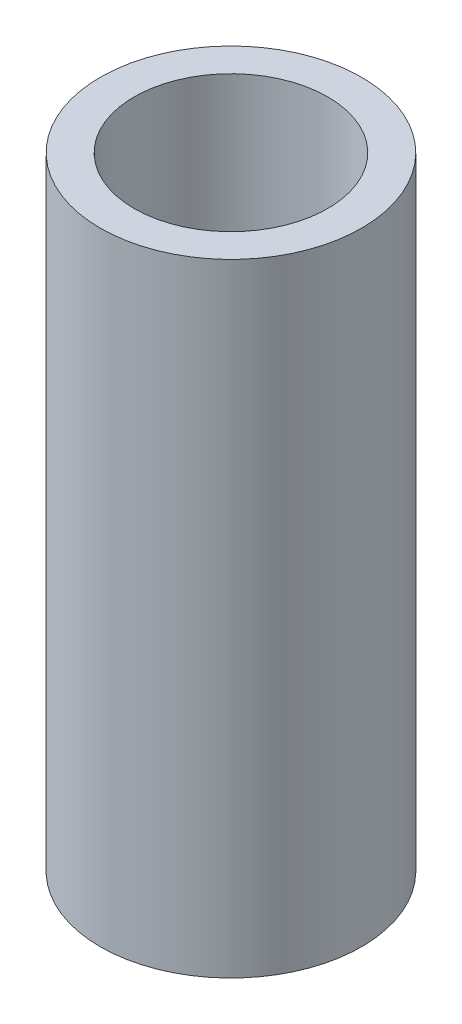
from build123d import *

# Parameters (mm, degrees)
SKETCH1_R           = 10.668
SKETCH1_R_2         = 7.8994
BOSS_EXTRUDE1_DEPTH = 50.8


with BuildPart() as part:
    # Sketch1 → Boss-Extrude1 (new body)
    with BuildSketch(Plane(origin=(0, 0, 0), x_dir=(1, 0, 0), z_dir=(0, 1, 0))):
        with Locations(Location((0, 0, 0), (0, 0, 270))):
            Circle(SKETCH1_R)
        with Locations(Location((0, 0, 0), (0, 0, 270))):
            Circle(SKETCH1_R_2, mode=Mode.SUBTRACT)
    extrude(amount=BOSS_EXTRUDE1_DEPTH)


solid = part.part
